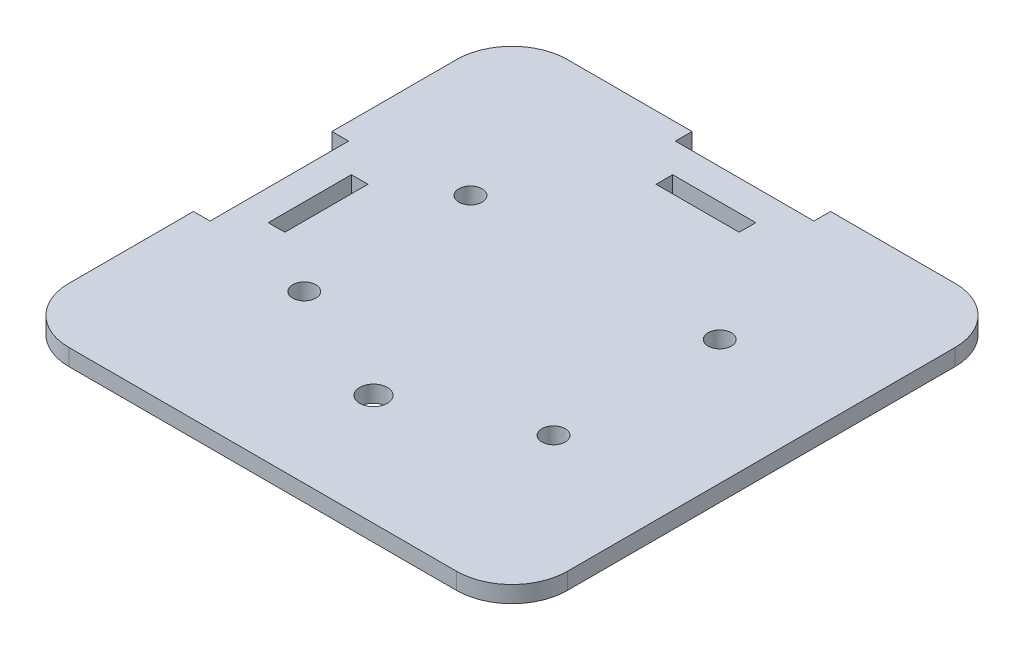
from build123d import *

# Parameters (mm, degrees)
BOSS_EXTRUDE1_DEPTH = 3
SKETCH2_R           = 2.1
CUT_EXTRUDE1_DEPTH  = 3
SKETCH3_W           = 15
SKETCH3_H           = 3
SKETCH3_W_2         = 3
SKETCH3_H_2         = 15
CUT_EXTRUDE2_DEPTH  = 10
SKETCH4_R           = 2.5
CUT_EXTRUDE3_DEPTH  = 14


with BuildPart() as part:
    # Sketch1 → Boss-Extrude1 (new body)
    with BuildSketch(Plane(origin=(0, 0, 0), x_dir=(1, 0, 0), z_dir=(0, 1, 0))):
        with BuildLine():
            Line((-35, -45), (35, -45))
            ThreePointArc((35, -45), (42.071067812, -42.071067812), (45, -35))
            Line((45, -35), (45, 35))
            ThreePointArc((45, 35), (42.071067812, 42.071067812), (35, 45))
            Line((35, 45), (12.5, 45))
            Line((12.5, 45), (12.5, 42))
            Line((12.5, 42), (-12.5, 42))
            Line((-12.5, 42), (-12.5, 45))
            Line((-12.5, 45), (-35, 45))
            ThreePointArc((-35, 45), (-42.071067812, 42.071067812), (-45, 35))
            Line((-45, 35), (-45, 12.5))
            Line((-45, 12.5), (-42, 12.5))
            Line((-42, 12.5), (-42, -12.5))
            Line((-42, -12.5), (-45, -12.5))
            Line((-45, -12.5), (-45, -35))
            ThreePointArc((-45, -35), (-42.071067812, -42.071067812), (-35, -45))
        make_face()
    extrude(amount=BOSS_EXTRUDE1_DEPTH)

    # Sketch2 → Cut-Extrude1 (cut)
    with BuildSketch(Plane(origin=(0, 3, 0), x_dir=(1, 0, 0), z_dir=(0, 1, 0))):
        with Locations(Location((-22.5, 15, 0), (0, 0, 270))):
            Circle(SKETCH2_R)
        with Locations(Location((22.5, 15, 0), (0, 0, 90))):
            Circle(SKETCH2_R)
        with Locations(Location((22.5, -15, 0), (0, 0, 270))):
            Circle(SKETCH2_R)
        with Locations(Location((-22.5, -15, 0), (0, 0, 90))):
            Circle(SKETCH2_R)
    extrude(amount=-CUT_EXTRUDE1_DEPTH, mode=Mode.SUBTRACT)

    # Sketch3 → Cut-Extrude2 (cut)
    with BuildSketch(Plane(origin=(0, 3, 0), x_dir=(1, 0, 0), z_dir=(0, 1, 0))):
        with Locations((0, 35)):
            Rectangle(SKETCH3_W, SKETCH3_H)
        with Locations((-35, 0)):
            Rectangle(SKETCH3_W_2, SKETCH3_H_2)
    extrude(amount=-CUT_EXTRUDE2_DEPTH, mode=Mode.SUBTRACT)

    # Sketch4 → Cut-Extrude3 (cut)
    with BuildSketch(Plane(origin=(0, 3, 0), x_dir=(1, 0, 0), z_dir=(0, 1, 0))):
        with Locations(Location((0, -25, 0), (0, 0, 270))):
            Circle(SKETCH4_R)
    extrude(amount=-CUT_EXTRUDE3_DEPTH, mode=Mode.SUBTRACT)


solid = part.part
